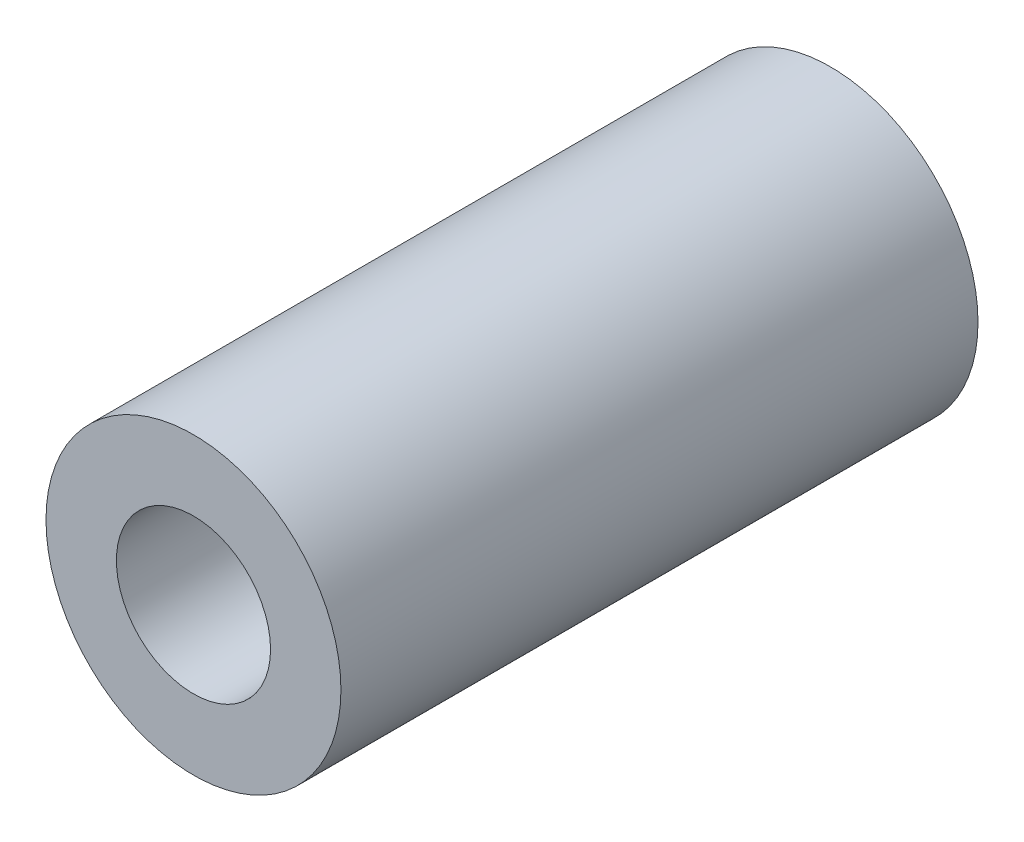
from build123d import *

# Parameters (mm, degrees)
SKETCH1_R           = 4.7625
SKETCH1_R_2         = 2.4892
BOSS_EXTRUDE1_DEPTH = 10.287


with BuildPart() as part:
    # Sketch1 → Boss-Extrude1 (new, symmetric)
    with BuildSketch(Plane.XY):
        Circle(SKETCH1_R)
        Circle(SKETCH1_R_2, mode=Mode.SUBTRACT)
    extrude(amount=BOSS_EXTRUDE1_DEPTH, both=True)


solid = part.part
